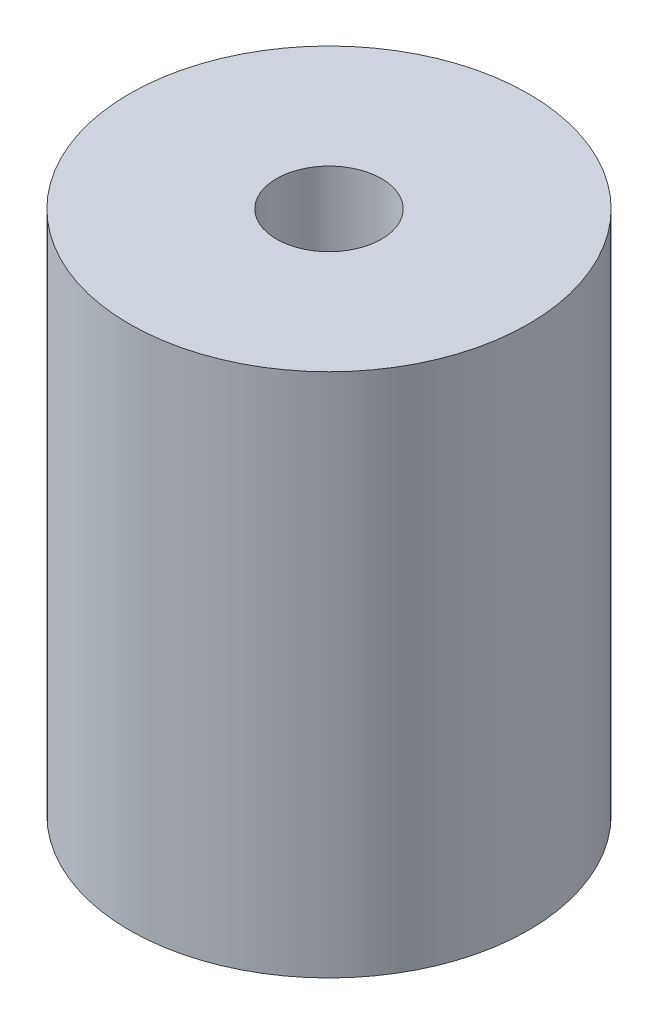
from build123d import *

# Parameters (mm, degrees)
SKETCH1_W = 7
SKETCH1_H = 25


with BuildPart() as part:
    # Sketch1 → Revolve1 (revolve)
    with BuildSketch(Plane.XY, mode=Mode.PRIVATE) as revolve1_sk:
        with Locations((6, 12.5)):
            Rectangle(SKETCH1_W, SKETCH1_H)
    revolve(revolve1_sk.sketch.rotate(Axis((0, 0, 0), (0, 1, 0)), 90), axis=Axis((0, 0, 0), (0, 1, 0)))


solid = part.part
